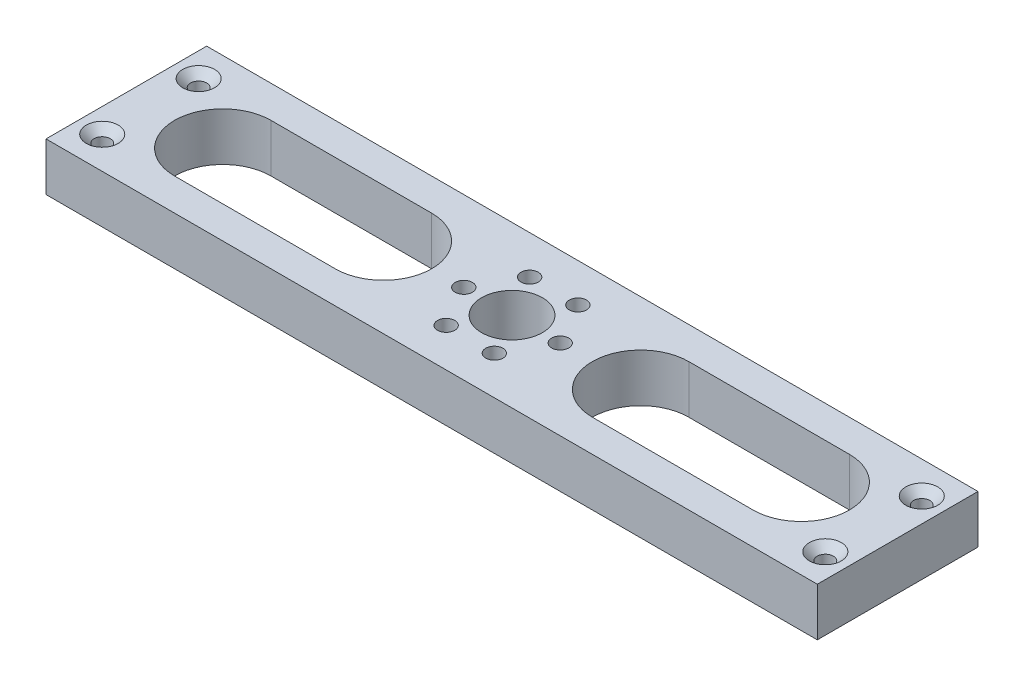
from build123d import *

# Parameters (mm, degrees)
SKETCH1_W                                       = 152.4
SKETCH1_H                                       = 31.75
BOSS_EXTRUDE1_DEPTH                             = 4.7625
CSK_FOR_M3_FLAT_HEAD_MACHINE_SCREW1_D           = 3.2
CSK_FOR_M3_FLAT_HEAD_MACHINE_SCREW1_CSINK_D     = 6.3
CSK_FOR_M3_FLAT_HEAD_MACHINE_SCREW1_CSINK_ANGLE = 90
F_12_0MM_DOWEL_HOLE1_D                          = 12
CBORE_FOR_M3_SHCS1_D                            = 3.4
CBORE_FOR_M3_SHCS1_CBORE_D                      = 4.5
CBORE_FOR_M3_SHCS1_CBORE_DEPTH                  = 2
CUT_EXTRUDE1_DEPTH                              = 79.416715374


with BuildPart() as part:
    # Sketch1 → Boss-Extrude1 (new, symmetric)
    with BuildSketch(Plane(origin=(0, 0, 0), x_dir=(1, 0, 0), z_dir=(0, 1, 0))):
        Rectangle(SKETCH1_W, SKETCH1_H)
    extrude(amount=BOSS_EXTRUDE1_DEPTH, both=True)

    # CSK for M3 Flat Head Machine Screw1 (through all)
    with Locations(Plane(origin=(0, 4.7625, 0), x_dir=(1, 0, 0), z_dir=(0, 1, 0))):
        with Locations((-71.4375, -9.525), (71.4375, -9.525), (71.4375, 9.525), (-71.4375, 9.525)):
            CounterSinkHole(CSK_FOR_M3_FLAT_HEAD_MACHINE_SCREW1_D / 2, CSK_FOR_M3_FLAT_HEAD_MACHINE_SCREW1_CSINK_D / 2, counter_sink_angle=CSK_FOR_M3_FLAT_HEAD_MACHINE_SCREW1_CSINK_ANGLE)

    # Ø12.0mm Dowel Hole1 (through all)
    with Locations(Plane(origin=(0, -4.7625, 0), x_dir=(-1, 0, 0), z_dir=(0, -1, 0))):
        with Locations((0, 0)):
            Hole(F_12_0MM_DOWEL_HOLE1_D / 2)

    # CBORE for M3 SHCS1 (through all)
    with Locations(Plane(origin=(0, -4.7625, 0), x_dir=(-1, 0, 0), z_dir=(0, -1, 0))):
        with Locations((4.7625, -8.248891971), (9.525, 0), (4.7625, 8.248891971), (-4.7625, 8.248891971), (-9.525, 0), (-4.7625, -8.248891971)):
            CounterBoreHole(CBORE_FOR_M3_SHCS1_D / 2, CBORE_FOR_M3_SHCS1_CBORE_D / 2, CBORE_FOR_M3_SHCS1_CBORE_DEPTH)

    # Sketch15 → Cut-Extrude1 (cut, through all)
    with BuildSketch(Plane(origin=(0, 4.7625, 0), x_dir=(1, 0, 0), z_dir=(0, 1, 0))):
        with BuildLine():
            Line((-57.15, 9.525), (-25.4, 9.525))
            ThreePointArc((-25.4, 9.525), (-15.875, 0), (-25.4, -9.525))
            Line((-25.4, -9.525), (-57.15, -9.525))
            ThreePointArc((-57.15, -9.525), (-66.675, 0), (-57.15, 9.525))
        make_face()
        with BuildLine():
            Line((25.4, 9.525), (57.15, 9.525))
            ThreePointArc((57.15, 9.525), (66.675, 0), (57.15, -9.525))
            Line((57.15, -9.525), (25.4, -9.525))
            ThreePointArc((25.4, -9.525), (15.875, 0), (25.4, 9.525))
        make_face()
    extrude(amount=-CUT_EXTRUDE1_DEPTH, mode=Mode.SUBTRACT)


solid = part.part
